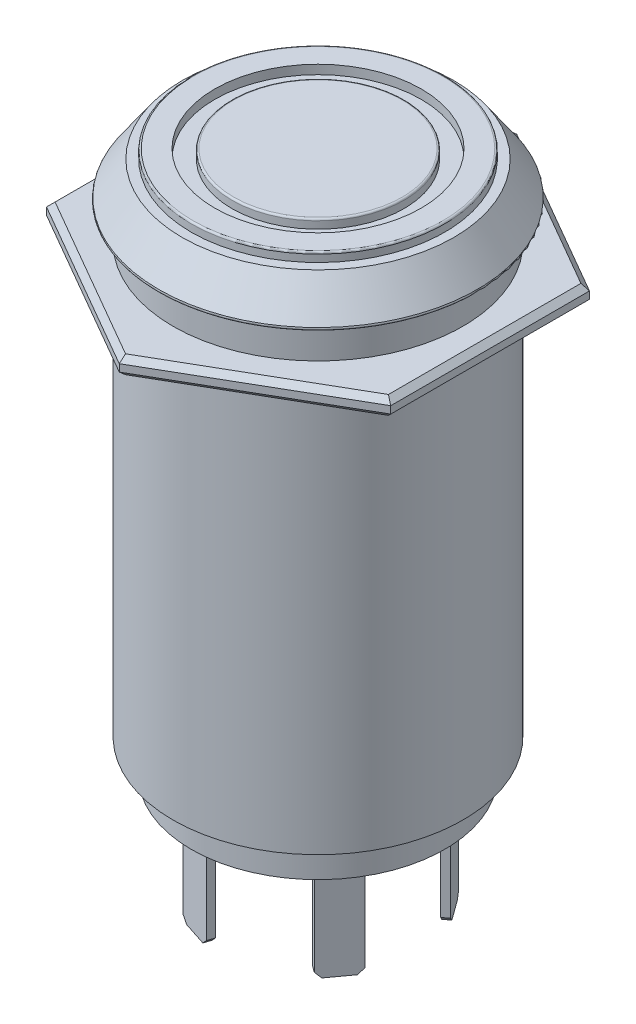
from build123d import *

# Parameters (mm, degrees)
SKETCH2_W           = 0.4
SKETCH2_H           = 2
BOSS_EXTRUDE1_DEPTH = 5.8
CHAMFER1_SIZE       = 0.3
SKETCH3_R           = 7
BOSS_EXTRUDE2_DEPTH = 0.5
SKETCH4_R           = 5.7
SKETCH4_R_2         = 4.75
CUT_EXTRUDE1_DEPTH  = 0.5
FILLET1_R           = 0.1
FILLET2_R           = 0.1
BOSS_EXTRUDE3_START = 1
SKETCH5_R           = 8
BOSS_EXTRUDE3_DEPTH = 1
CHAMFER2_SIZE       = 0.3


with BuildPart() as part:
    # Sketch1 → Revolve1 (revolve)
    with BuildSketch(Plane.XY, mode=Mode.PRIVATE) as revolve1_sk:
        Polygon((0, 14.75), (-7.5, 14.75), (-8.9, 12.75), (-8, 12.75), (-8, -12.85), (-7, -12.85), (-7, -14.75), (0, -14.75), align=None)
    revolve(revolve1_sk.sketch.rotate(Axis((0, 14.75, 0), (0, -1, 0)), 270), axis=Axis((0, 14.75, 0), (0, -1, 0)))

    # Sketch2 → Boss-Extrude1 (add)
    with BuildSketch(Plane.XZ.offset(14.75)):
        with Locations((-5.2, 0)):
            Rectangle(SKETCH2_W, SKETCH2_H)
        Polygon((-0.717635253, 5.444722182), (-0.594028456, 5.064299576), (-2.496141488, 4.446265587), (-2.619748286, 4.826688194), align=None)
        Polygon((4.956477022, 2.365023368), (4.632870224, 2.129909267), (3.45729972, 3.747943256), (3.780906517, 3.983057357), align=None)
        Polygon((3.780906517, -3.983057357), (3.45729972, -3.747943256), (4.632870224, -2.129909267), (4.956477022, -2.365023368), align=None)
        Polygon((-2.619748286, -4.826688194), (-2.496141488, -4.446265587), (-0.594028456, -5.064299576), (-0.717635253, -5.444722182), align=None)
    extrude(amount=BOSS_EXTRUDE1_DEPTH)

    # Chamfer1
    chamfer1_edges = [part.edges().sort_by_distance(p)[0] for p in [
        (-5.2, -20.55, -1),
        (-5.2, -20.55, 1),
        (-2.557944887, -20.55, 4.63647689),
        (-0.655831854, -20.55, 5.254510879),
        (3.619103118, -20.55, 3.865500306),
        (4.794673623, -20.55, 2.247466318),
        (4.794673623, -20.55, -2.247466318),
        (3.619103118, -20.55, -3.865500306),
        (-0.655831854, -20.55, -5.254510879),
        (-2.557944887, -20.55, -4.63647689),
    ]]
    chamfer(chamfer1_edges, length=CHAMFER1_SIZE)

    # Sketch3 → Boss-Extrude2 (add)
    with BuildSketch(Plane(origin=(0, 14.75, 0), x_dir=(1, 0, 0), z_dir=(0, 1, 0))):
        with Locations(Location((0, 0, 0), (0, 0, 270))):
            Circle(SKETCH3_R)
    extrude(amount=BOSS_EXTRUDE2_DEPTH)

    # Sketch4 → Cut-Extrude1 (cut)
    with BuildSketch(Plane(origin=(0, 15.25, 0), x_dir=(1, 0, 0), z_dir=(0, 1, 0))):
        with Locations(Location((0, 0, 0), (0, 0, 270))):
            Circle(SKETCH4_R)
        with Locations(Location((0, 0, 0), (0, 0, 270))):
            Circle(SKETCH4_R_2, mode=Mode.SUBTRACT)
    extrude(amount=-CUT_EXTRUDE1_DEPTH, mode=Mode.SUBTRACT)

    # Fillet1
    fillet1_edges = [part.edges().sort_by_distance(p)[0] for p in [
        (0, 15.25, -7),
        (0, 15.25, -4.75),
    ]]
    fillet(fillet1_edges, radius=FILLET1_R)

    # Fillet2
    fillet2_edges = [part.edges().sort_by_distance(p)[0] for p in [
        (0, 12.75, -8.9),
    ]]
    fillet(fillet2_edges, radius=FILLET2_R)

    # Sketch5 → Boss-Extrude3 (add)
    with BuildSketch(Plane(origin=(0, 10.75, 0), x_dir=(-1, 0, 0), z_dir=(0, -1, 0)).offset(BOSS_EXTRUDE3_START)):
        Polygon((0, 10.969655115), (-9.5, 5.484827557), (-9.5, -5.484827557), (0, -10.969655115), (9.5, -5.484827557), (9.5, 5.484827557), align=None)
        with Locations(Location((0, 0, 0), (0, 0, 270))):
            Circle(SKETCH5_R, mode=Mode.SUBTRACT)
    extrude(amount=-BOSS_EXTRUDE3_DEPTH)

    # Chamfer2
    chamfer2_edges = [part.edges().sort_by_distance(p)[0] for p in [
        (-4.75, 9.75, -8.227241336),
        (4.75, 9.75, -8.227241336),
        (9.5, 9.75, 0),
        (4.75, 9.75, 8.227241336),
        (-4.75, 9.75, 8.227241336),
        (-9.5, 9.75, 0),
        (-4.75, 10.75, -8.227241336),
        (4.75, 10.75, -8.227241336),
        (9.5, 10.75, 0),
        (4.75, 10.75, 8.227241336),
        (-4.75, 10.75, 8.227241336),
        (-9.5, 10.75, 0),
    ]]
    chamfer(chamfer2_edges, length=CHAMFER2_SIZE)


solid = part.part
